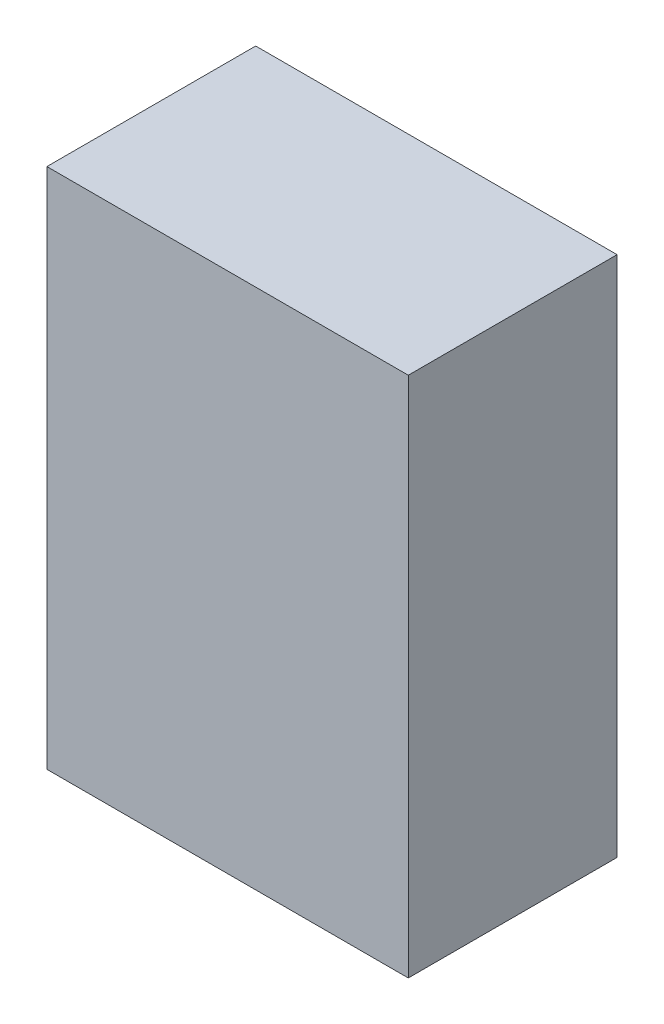
from build123d import *

# Parameters (mm, degrees)
SKETCH1_W           = 45
SKETCH1_H           = 65
BOSS_EXTRUDE1_DEPTH = 26


with BuildPart() as part:
    # Sketch1 → Boss-Extrude1 (new body)
    with BuildSketch(Plane.XY):
        with Locations((22.5, 32.5)):
            Rectangle(SKETCH1_W, SKETCH1_H)
    extrude(amount=BOSS_EXTRUDE1_DEPTH)


solid = part.part
